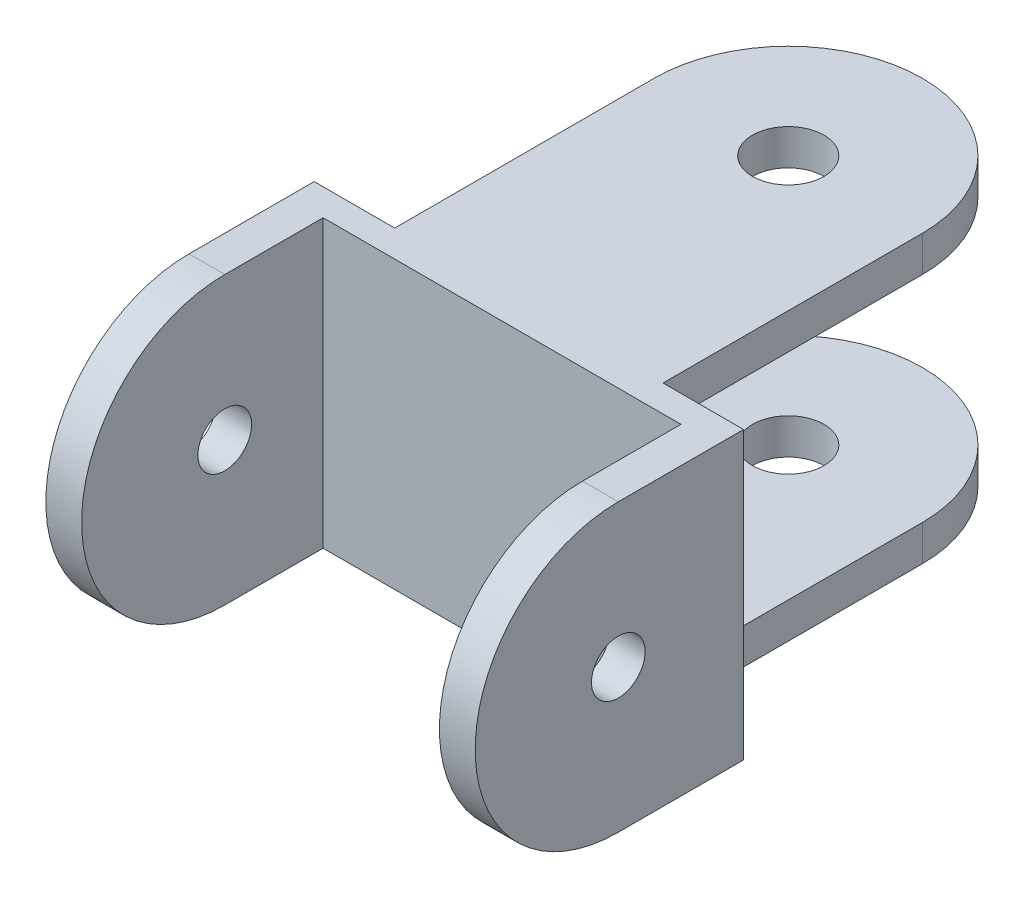
from build123d import *

# Parameters (mm, degrees)
BOSS_EXTRUDE1_START = 12
SKETCH1_R           = 4
BOSS_EXTRUDE1_DEPTH = 4
BOSS_EXTRUDE2_START = -12
SKETCH1_2_R         = 4
BOSS_EXTRUDE2_DEPTH = 4
SKETCH2_W           = 30
SKETCH2_H           = 32
BOSS_EXTRUDE3_DEPTH = 4
SKETCH3_W           = 48
SKETCH3_H           = 32
BOSS_EXTRUDE4_DEPTH = 3
SKETCH3_3_W         = 4
SKETCH3_3_H         = 32
BOSS_EXTRUDE5_DEPTH = 30
SKETCH4_R           = 3
CUT_EXTRUDE1_DEPTH  = 78.723870207


with BuildPart() as part:
    # Sketch1 → Boss-Extrude1 (new body)
    with BuildSketch(Plane(origin=(0, 0, 0), x_dir=(1, 0, 0), z_dir=(0, 1, 0)).offset(BOSS_EXTRUDE1_START)):
        with BuildLine():
            Line((-15, 0), (-15, -25))
            Line((-15, -25), (15, -25))
            Line((15, -25), (15, 0))
            ThreePointArc((15, 0), (0, 15), (-15, 0))
        make_face()
        with Locations(Location((0, 0, 0), (0, 0, 270))):
            Circle(SKETCH1_R, mode=Mode.SUBTRACT)
    extrude(amount=BOSS_EXTRUDE1_DEPTH)



with BuildPart() as body_2:
    # Sketch1<2> → Boss-Extrude2 (new body)
    with BuildSketch(Plane(origin=(0, 0, 0), x_dir=(1, 0, 0), z_dir=(0, 1, 0)).offset(BOSS_EXTRUDE2_START)):
        with BuildLine():
            Line((-15, 0), (-15, -25))
            Line((-15, -25), (15, -25))
            Line((15, -25), (15, 0))
            ThreePointArc((15, 0), (0, 15), (-15, 0))
        make_face()
        with Locations(Location((0, 0, 0), (0, 0, 270))):
            Circle(SKETCH1_2_R, mode=Mode.SUBTRACT)
    extrude(amount=-BOSS_EXTRUDE2_DEPTH)


with BuildPart() as part_1:
    add(part.part)

    add(body_2.part)  # Boss-Extrude3 merges body 2
    # Sketch2 → Boss-Extrude3 (add)
    with BuildSketch(Plane.XY.offset(25)):
        Rectangle(SKETCH2_W, SKETCH2_H)
    extrude(amount=BOSS_EXTRUDE3_DEPTH)

    # Sketch3 → Boss-Extrude4 (add)
    with BuildSketch(Plane.XY.offset(29)):
        Rectangle(SKETCH3_W, SKETCH3_H)
    extrude(amount=BOSS_EXTRUDE4_DEPTH)

    # Sketch3<3> → Boss-Extrude5 (add)
    with BuildSketch(Plane.XY.offset(29)):
        with Locations((22, 0)):
            Rectangle(SKETCH3_3_W, SKETCH3_3_H)
        with Locations((-22, 0)):
            Rectangle(SKETCH3_3_W, SKETCH3_3_H)
    extrude(amount=BOSS_EXTRUDE5_DEPTH)

    # Sketch4 → Cut-Extrude1 (cut, through all)
    with BuildSketch(Plane(origin=(-24, 0, 0), x_dir=(0, -1, 0), z_dir=(1, 0, 0))):
        with BuildLine():
            Line((16, -59), (16, -43))
            ThreePointArc((16, -43), (11.313708499, -54.313708499), (0, -59))
            Line((0, -59), (16, -59))
        make_face()
        with Locations((0, -43)):
            Circle(SKETCH4_R)
        with BuildLine():
            Line((-16, -59), (0, -59))
            ThreePointArc((0, -59), (-11.313708499, -54.313708499), (-16, -43))
            Line((-16, -43), (-16, -59))
        make_face()
    extrude(amount=CUT_EXTRUDE1_DEPTH, mode=Mode.SUBTRACT)


solid = part_1.part
